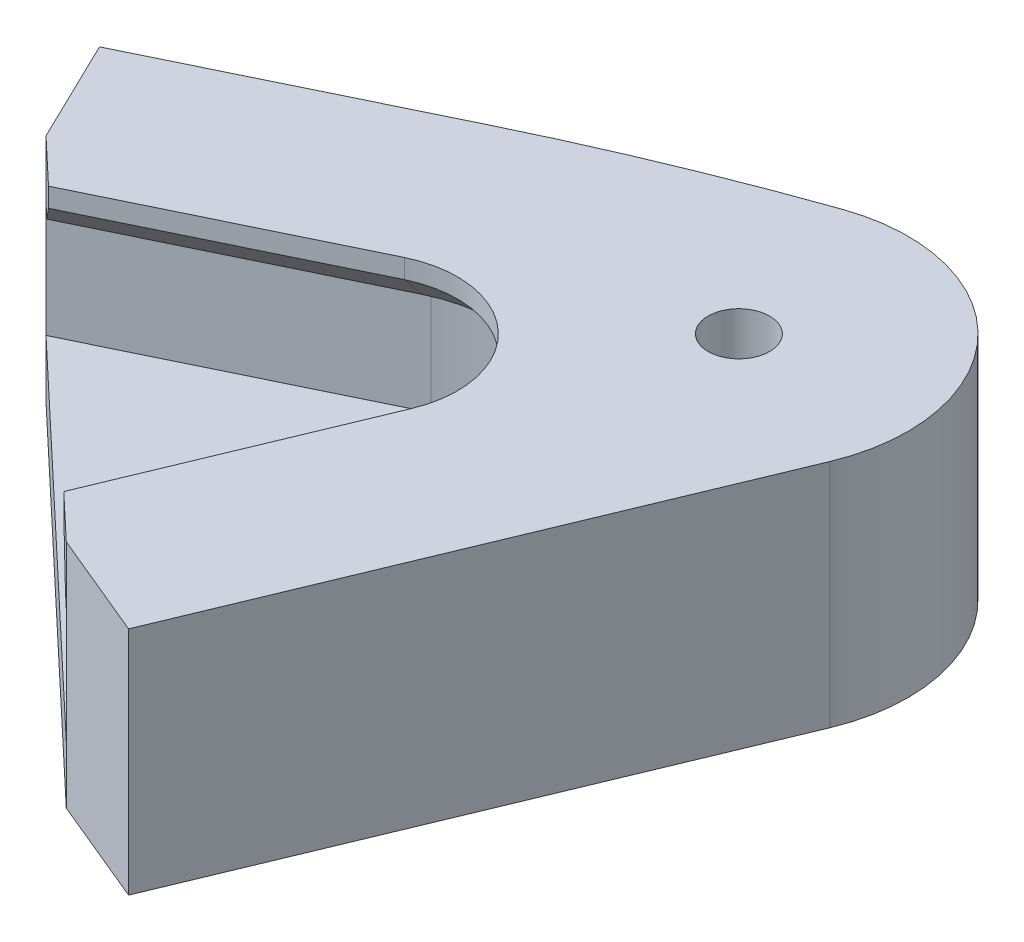
from build123d import *
from build123d.topology import SkipClean

# Parameters (mm, degrees)
SKETCH1_R           = 1.6
BOSS_EXTRUDE1_DEPTH = 6
BOSS_EXTRUDE3_START = 3
SKETCH7_R           = 1.6
BOSS_EXTRUDE3_DEPTH = 3
SKETCH8_R           = 1.6
BOSS_EXTRUDE4_DEPTH = 3
CHAMFER1_SIZE       = 2


with BuildPart() as part:
    # Sketch1 → Boss-Extrude1 (new body)
    with BuildSketch(Plane(origin=(0, 0, 0), x_dir=(1, 0, 0), z_dir=(0, 1, 0))):
        with BuildLine():
            Line((40.930223616, 79.991972891), (54.42997891, 86.530826536))
            ThreePointArc((54.42997891, 86.530826536), (63.577181794, 85.122585909), (65.51014962, 76.071724202))
            Line((65.51014962, 76.071724202), (59.760023318, 62.21762562))
            Line((59.760023318, 62.21762562), (65.30166275, 59.917575099))
            Line((65.30166275, 59.917575099), (76.011513854, 85.721414039))
            ThreePointArc((76.011513854, 85.721414039), (74.278699447, 95.141487045), (64.97108226, 97.401726747))
            ThreePointArc((64.97108226, 97.401726747), (58.314802122, 94.853700296), (51.814437452, 91.930728654))
            Line((51.814437452, 91.930728654), (38.314682158, 85.391875009))
            Line((38.314682158, 85.391875009), (40.930223616, 79.991972891))
        make_face()
        with Locations(Location((67.882250994, 89.09545443, 0), (0, 0, 270))):
            Circle(SKETCH1_R, mode=Mode.SUBTRACT)
    extrude(amount=BOSS_EXTRUDE1_DEPTH)

    # Sketch7 → Boss-Extrude3 (add)
    with SkipClean():  # the faces are left unmerged after this step: merging them gives an invalid solid
        with BuildSketch(Plane.XZ.offset(BOSS_EXTRUDE3_START)):
            with BuildLine():
                Line((76.011513854, -85.721414039), (65.30166275, -59.917575099))
                Line((65.30166275, -59.917575099), (59.760023318, -62.21762562))
                Line((59.760023318, -62.21762562), (40.930223616, -79.991972891))
                Line((40.930223616, -79.991972891), (38.314682158, -85.391875009))
                Line((38.314682158, -85.391875009), (51.814437452, -91.930728654))
                ThreePointArc((51.814437452, -91.930728654), (58.314802122, -94.853700296), (64.97108226, -97.401726747))
                ThreePointArc((64.97108226, -97.401726747), (74.278699447, -95.141487045), (76.011513854, -85.721414039))
            make_face()
            with Locations(Location((67.882250994, -89.09545443, 0), (0, 0, 270))):
                Circle(SKETCH7_R, mode=Mode.SUBTRACT)
            with Locations(Location((57.982756057, -79.195959493, 0), (0, 0, 270))):
                Circle(SKETCH7_R, mode=Mode.SUBTRACT)
        extrude(amount=-BOSS_EXTRUDE3_DEPTH)

    # Sketch8 → Boss-Extrude4 (add)
    with BuildSketch(Plane(origin=(0, 6, 0), x_dir=(1, 0, 0), z_dir=(0, 1, 0))):
        with BuildLine():
            Line((38.314682158, 85.391875009), (40.930223616, 79.991972891))
            Line((40.930223616, 79.991972891), (43.264016412, 77.788994406))
            Line((43.264016412, 77.788994406), (55.737749639, 83.830875477))
            ThreePointArc((55.737749639, 83.830875477), (61.517883977, 82.941005633), (62.739329904, 77.221749462))
            Line((62.739329904, 77.221749462), (57.426230521, 64.420604105))
            Line((57.426230521, 64.420604105), (59.760023318, 62.21762562))
            Line((59.760023318, 62.21762562), (65.30166275, 59.917575099))
            Line((65.30166275, 59.917575099), (76.011513854, 85.721414039))
            ThreePointArc((76.011513854, 85.721414039), (74.278699447, 95.141487045), (64.97108226, 97.401726747))
            ThreePointArc((64.97108226, 97.401726747), (58.314802122, 94.853700296), (51.814437452, 91.930728654))
            Line((51.814437452, 91.930728654), (38.314682158, 85.391875009))
        make_face()
        with Locations(Location((67.882250994, 89.09545443, 0), (0, 0, 90))):
            Circle(SKETCH8_R, mode=Mode.SUBTRACT)
    extrude(amount=BOSS_EXTRUDE4_DEPTH)

    # Chamfer1
    chamfer1_edges = [part.edges().sort_by_distance(p)[0] for p in [
        (49.500883026, 6, -80.809934942),
        (61.517883977, 6, -82.941005633),
        (60.082780212, 6, -70.821176784),
    ]]
    chamfer(chamfer1_edges, length=CHAMFER1_SIZE)


solid = part.part
